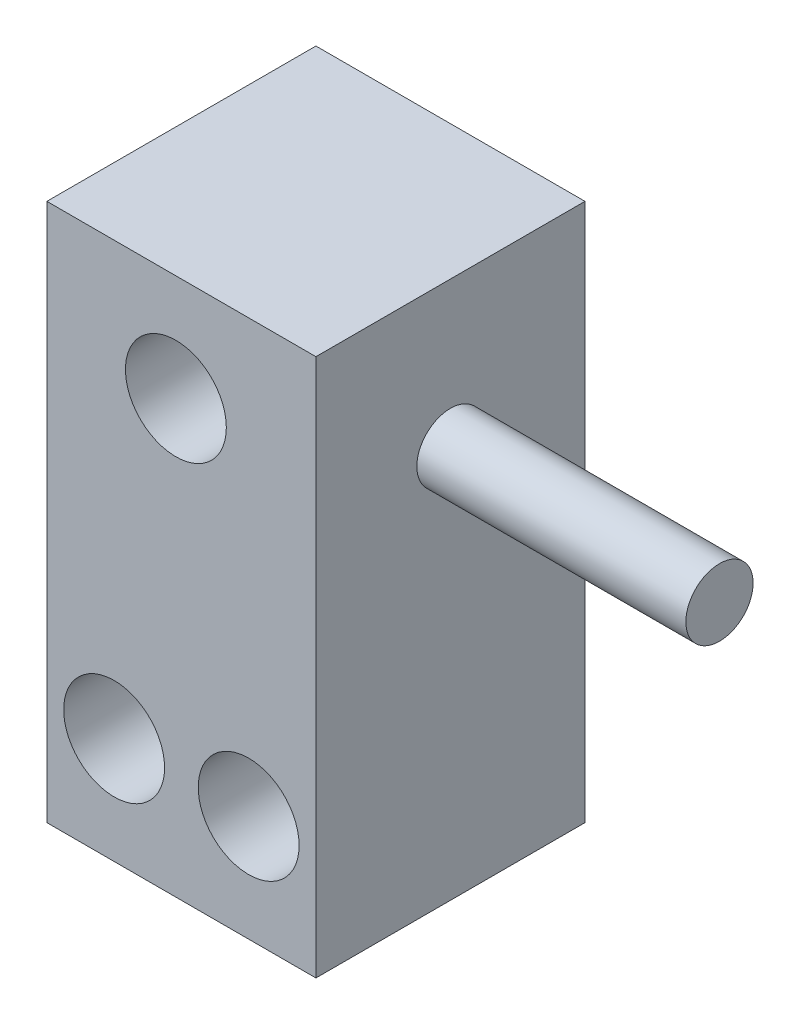
from build123d import *

# Parameters (mm, degrees)
SKETCH7_W           = 20
SKETCH7_H           = 40
SKETCH7_R           = 3.75
BOSS_EXTRUDE4_DEPTH = 20
SKETCH8_R           = 2.5
BOSS_EXTRUDE5_DEPTH = 20


with BuildPart() as part:
    # Sketch7 → Boss-Extrude4 (new body)
    with BuildSketch(Plane.XY):
        with Locations((10, 20)):
            Rectangle(SKETCH7_W, SKETCH7_H)
        with Locations((15, 7.90672248)):
            Circle(SKETCH7_R, mode=Mode.SUBTRACT)
        with Locations((5, 7.90672248)):
            Circle(SKETCH7_R, mode=Mode.SUBTRACT)
        with Locations((9.590015998, 32.1)):
            Circle(SKETCH7_R, mode=Mode.SUBTRACT)
    extrude(amount=BOSS_EXTRUDE4_DEPTH)

    # Sketch8 → Boss-Extrude5 (add)
    with BuildSketch(Plane(origin=(20, 0, 0), x_dir=(0, 0, -1), z_dir=(1, 0, 0))):
        with Locations(Location((-10, 29.176257045, 0), (0, 0, 180))):
            Circle(SKETCH8_R)
    extrude(amount=BOSS_EXTRUDE5_DEPTH)


solid = part.part
